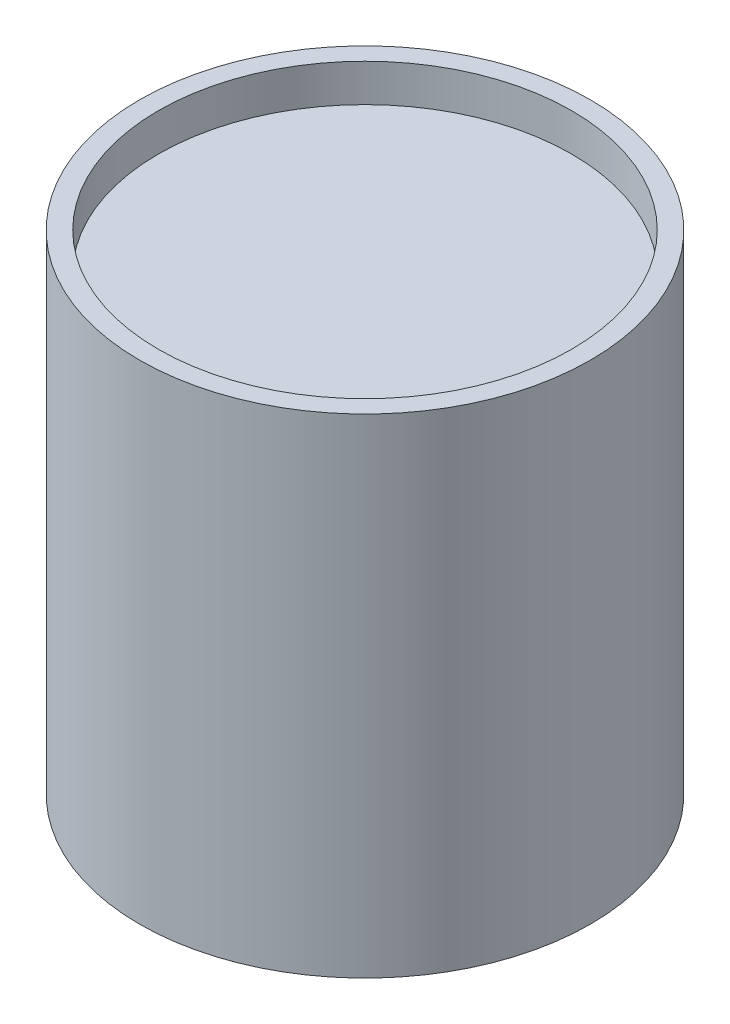
from build123d import *

# Parameters (mm, degrees)
SKETCH_1_R          = 30
EXTRUDE_1_DEPTH     = 65
SKETCH_2_R          = 27.5
CUT_EXTRUDE_1_DEPTH = 5
CUT_EXTRUDE_START   = -57
SKETCH_3_R          = 27.5
CUT_EXTRUDE_2_DEPTH = 57


with BuildPart() as part:
    # 草图1 → 凸台-拉伸1 (new body)
    with BuildSketch(Plane(origin=(0, 0, 0), x_dir=(1, 0, 0), z_dir=(0, 1, 0))):
        with Locations(Location((0, 0, 0), (0, 0, 270))):
            Circle(SKETCH_1_R)
    extrude(amount=EXTRUDE_1_DEPTH)

    # 草图2 → 切除-拉伸1 (cut)
    with BuildSketch(Plane(origin=(0, 65, 0), x_dir=(1, 0, 0), z_dir=(0, 1, 0))):
        with Locations(Location((0, 0, 0), (0, 0, 270))):
            Circle(SKETCH_2_R)
    extrude(amount=-CUT_EXTRUDE_1_DEPTH, mode=Mode.SUBTRACT)

    # 草图3 → 切除-拉伸2 (cut)
    with BuildSketch(Plane.XZ.offset(CUT_EXTRUDE_START)):
        with Locations(Location((0, 0, 0), (0, 0, 90))):
            Circle(SKETCH_3_R)
    extrude(amount=CUT_EXTRUDE_2_DEPTH, mode=Mode.SUBTRACT)


solid = part.part
